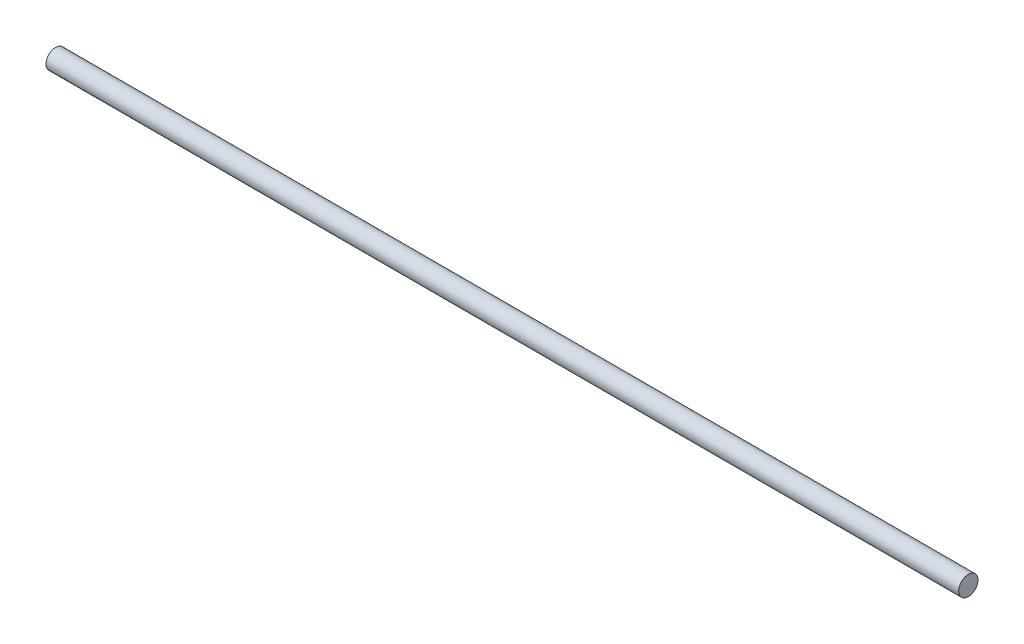
from build123d import *

# Parameters (mm, degrees)
SKETCH1_R           = 3.175
BOSS_EXTRUDE1_DEPTH = 149.987


with BuildPart() as part:
    # Sketch1 → Boss-Extrude1 (new, symmetric)
    with BuildSketch(Plane(origin=(0, 0, 0), x_dir=(0, 0, -1), z_dir=(1, 0, 0))):
        Circle(SKETCH1_R)
    extrude(amount=BOSS_EXTRUDE1_DEPTH, both=True)


solid = part.part
